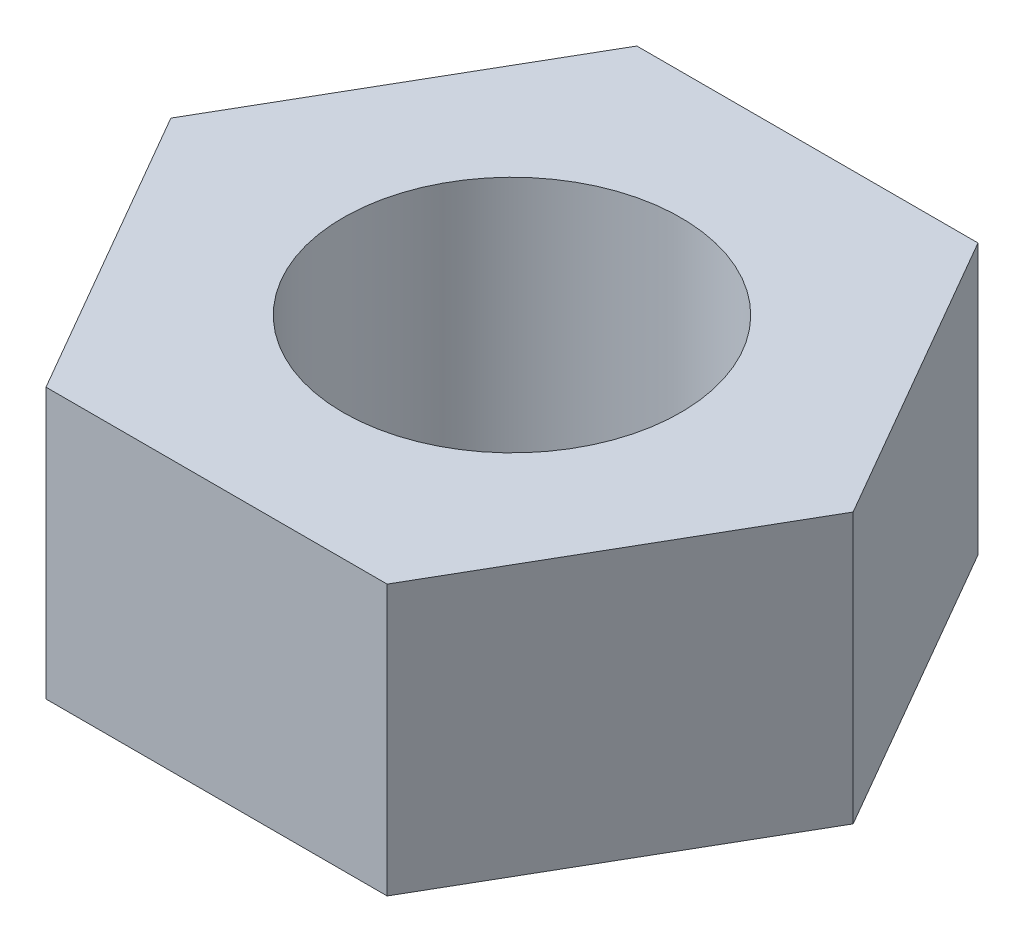
from build123d import *

# Parameters (mm, degrees)
CROQUIS1_R              = 2
SALIENTE_EXTRUIR1_DEPTH = 3.2


with BuildPart() as part:
    # Croquis1 → Saliente-Extruir1 (new body)
    with BuildSketch(Plane(origin=(0, 0, 0), x_dir=(1, 0, 0), z_dir=(0, 1, 0))):
        Polygon((-2.020725942, 3.5), (-4.041451884, 0), (-2.020725942, -3.5), (2.020725942, -3.5), (4.041451884, 0), (2.020725942, 3.5), align=None)
        with Locations(Location((0, 0, 0), (0, 0, 270))):
            Circle(CROQUIS1_R, mode=Mode.SUBTRACT)
    extrude(amount=SALIENTE_EXTRUIR1_DEPTH)


solid = part.part
